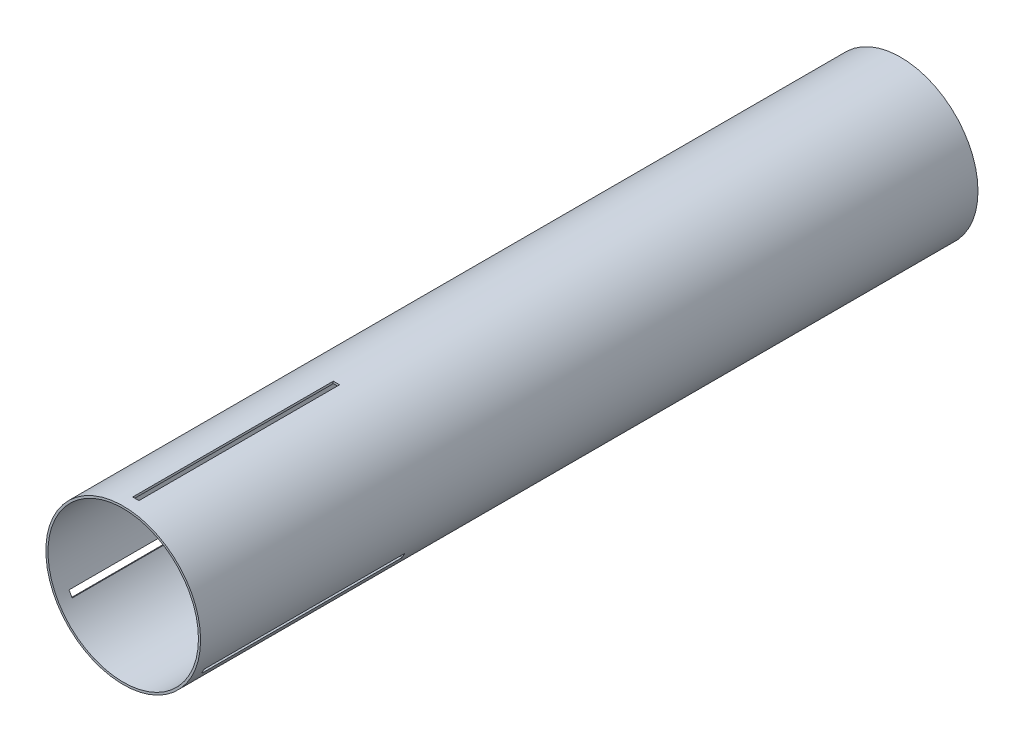
from build123d import *

# Parameters (mm, degrees)
ESQUISSE2_R                  = 78.359
ESQUISSE2_R_2                = 76.2
BOSS_EXTRU_1_DEPTH           = 787.4
ESQUISSE3_W                  = 6.35
ESQUISSE3_H                  = 203.2
ENL_V_MAT_EXTRU_1_DEPTH      = 153.416
R_P_TITION_CIRCULAIRE1_COUNT = 3


with BuildPart() as part:
    # Esquisse2 → Boss.-Extru.1 (new body)
    with BuildSketch(Plane.XY):
        Circle(ESQUISSE2_R)
        Circle(ESQUISSE2_R_2, mode=Mode.SUBTRACT)
    extrude(amount=BOSS_EXTRU_1_DEPTH)

    # Esquisse3 → Enlèv. mat.-Extru.1 (cut)
    with BuildSketch(Plane(origin=(0, 0, 0), x_dir=(1, 0, 0), z_dir=(0, 1, 0))):
        with Locations((0, -673.1)):
            Rectangle(ESQUISSE3_W, ESQUISSE3_H)
    enl_v_mat_extru_1 = extrude(amount=ENL_V_MAT_EXTRU_1_DEPTH, mode=Mode.SUBTRACT)

    # Répétition circulaire1: Enlèv. mat.-Extru.1 ×3 about axis
    r_p_tition_circulaire1_axis = Axis((0, 0, 0), (0, 0, 1))
    for i in range(1, R_P_TITION_CIRCULAIRE1_COUNT):
        add(enl_v_mat_extru_1.rotate(r_p_tition_circulaire1_axis, i * 360 / R_P_TITION_CIRCULAIRE1_COUNT), mode=Mode.SUBTRACT)


solid = part.part
